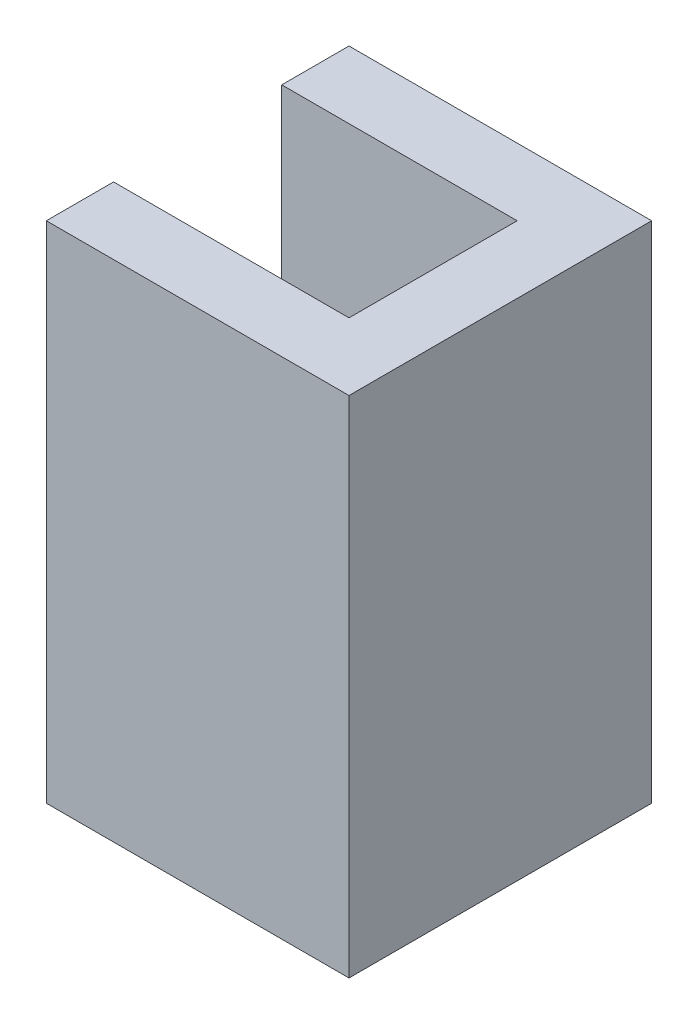
from build123d import *

# Parameters (mm, degrees)
SKETCH1_W           = 9
SKETCH1_H           = 9
SKETCH1_W_2         = 5
SKETCH1_H_2         = 5
BOSS_EXTRUDE1_DEPTH = 15
SKETCH2_W           = 2
SKETCH2_H           = 5
CUT_EXTRUDE1_DEPTH  = 17.294170737


with BuildPart() as part:
    # Sketch1 → Boss-Extrude1 (new body)
    with BuildSketch(Plane(origin=(0, 0, 0), x_dir=(1, 0, 0), z_dir=(0, 1, 0))):
        Rectangle(SKETCH1_W, SKETCH1_H)
        Rectangle(SKETCH1_W_2, SKETCH1_H_2, mode=Mode.SUBTRACT)
    extrude(amount=BOSS_EXTRUDE1_DEPTH)

    # Sketch2 → Cut-Extrude1 (cut, through all)
    with BuildSketch(Plane(origin=(0, 15, 0), x_dir=(1, 0, 0), z_dir=(0, 1, 0))):
        with Locations((-3.5, 0)):
            Rectangle(SKETCH2_W, SKETCH2_H)
    extrude(amount=-CUT_EXTRUDE1_DEPTH, mode=Mode.SUBTRACT)


solid = part.part
